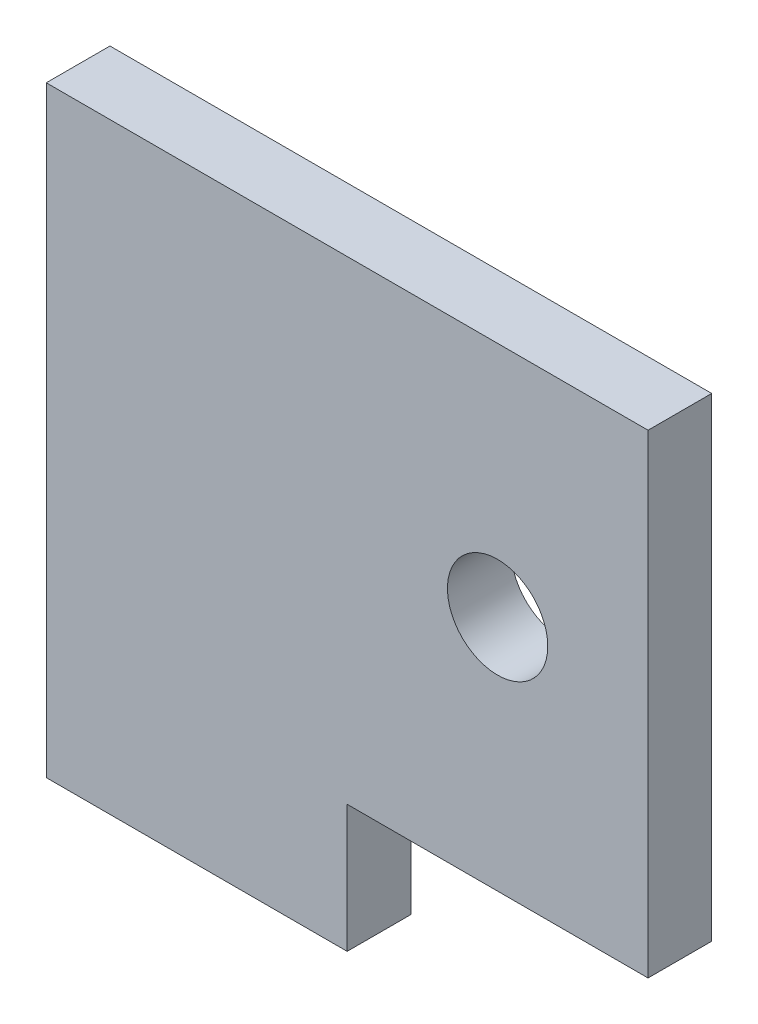
from build123d import *

# Parameters (mm, degrees)
SKETCH1_R           = 2.5
BOSS_EXTRUDE1_DEPTH = 3.175


with BuildPart() as part:
    # Sketch1 → Boss-Extrude1 (new body)
    with BuildSketch(Plane.XY):
        Polygon((15, 0), (15, 6.35), (30, 6.35), (30, 30), (0, 30), (0, 0), align=None)
        with Locations((22.5, 18.175)):
            Circle(SKETCH1_R, mode=Mode.SUBTRACT)
    extrude(amount=BOSS_EXTRUDE1_DEPTH)


solid = part.part
